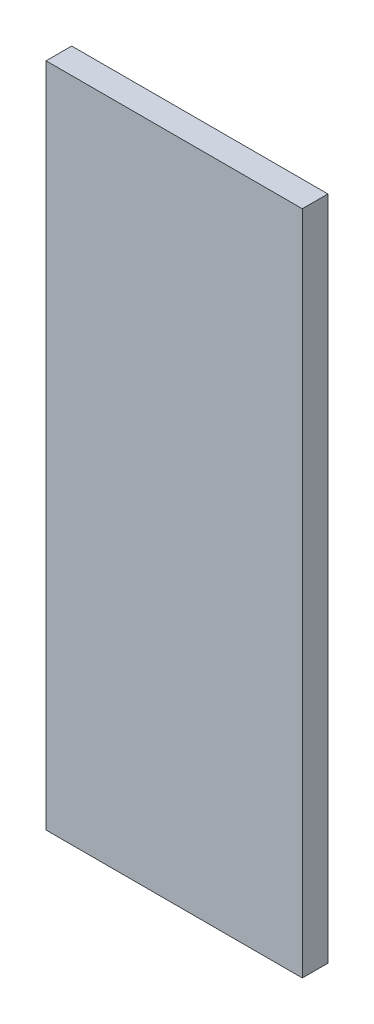
from build123d import *

# Parameters (mm, degrees)
SKETCH1_W           = 50
SKETCH1_H           = 130
BOSS_EXTRUDE2_DEPTH = 5


with BuildPart() as part:
    # Sketch1 → Boss-Extrude2 (new body)
    with BuildSketch(Plane.XY):
        Rectangle(SKETCH1_W, SKETCH1_H)
    extrude(amount=BOSS_EXTRUDE2_DEPTH)


solid = part.part
